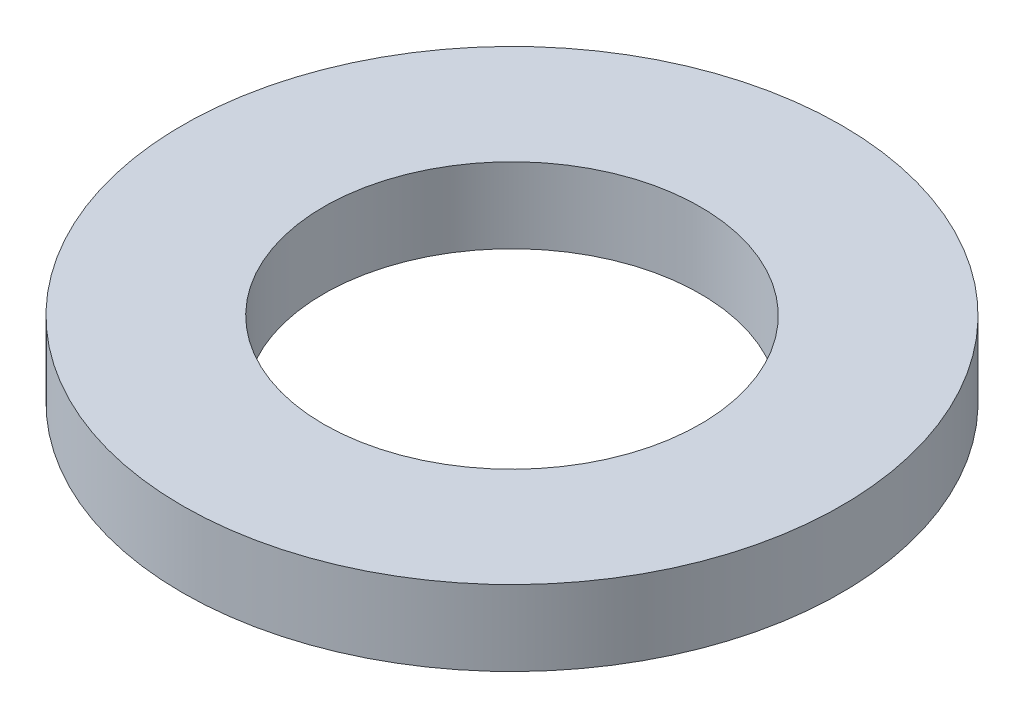
from build123d import *

# Parameters (mm, degrees)
SKETCH1_R           = 7
SKETCH1_R_2         = 4
BOSS_EXTRUDE1_DEPTH = 1.6


with BuildPart() as part:
    # Sketch1 → Boss-Extrude1 (new body)
    with BuildSketch(Plane(origin=(0, 0, 0), x_dir=(1, 0, 0), z_dir=(0, 1, 0))):
        with Locations(Location((0, 0, 0), (0, 0, 270))):
            Circle(SKETCH1_R)
        with Locations(Location((0, 0, 0), (0, 0, 270))):
            Circle(SKETCH1_R_2, mode=Mode.SUBTRACT)
    extrude(amount=BOSS_EXTRUDE1_DEPTH)


solid = part.part
